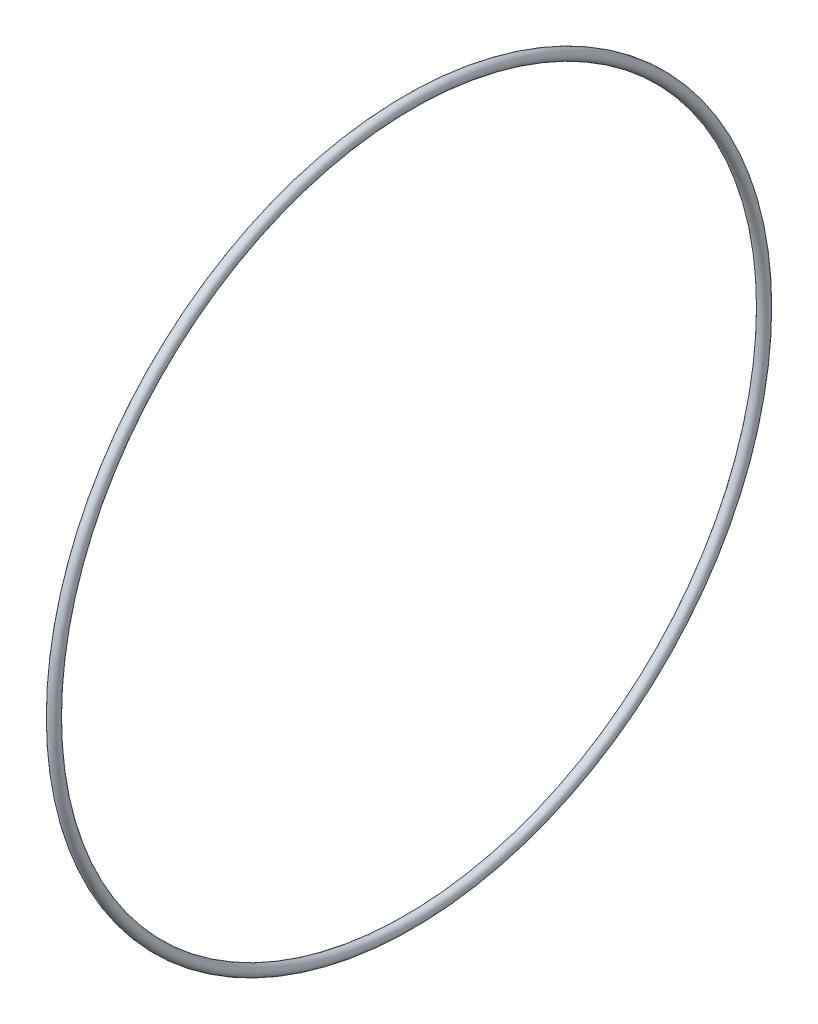
from build123d import *

# Parameters (mm, degrees)
SKETCH1_R = 1.666666667


with BuildPart() as part:
    # Sketch1 → Revolve1 (revolve)
    with BuildSketch(Plane.XY, mode=Mode.PRIVATE) as revolve1_sk:
        with Locations((0, 110)):
            Circle(SKETCH1_R)
    revolve(revolve1_sk.sketch.rotate(Axis((-73.342827111, 0, 0), (1, 0, 0)), 90), axis=Axis((-73.342827111, 0, 0), (1, 0, 0)))


solid = part.part
